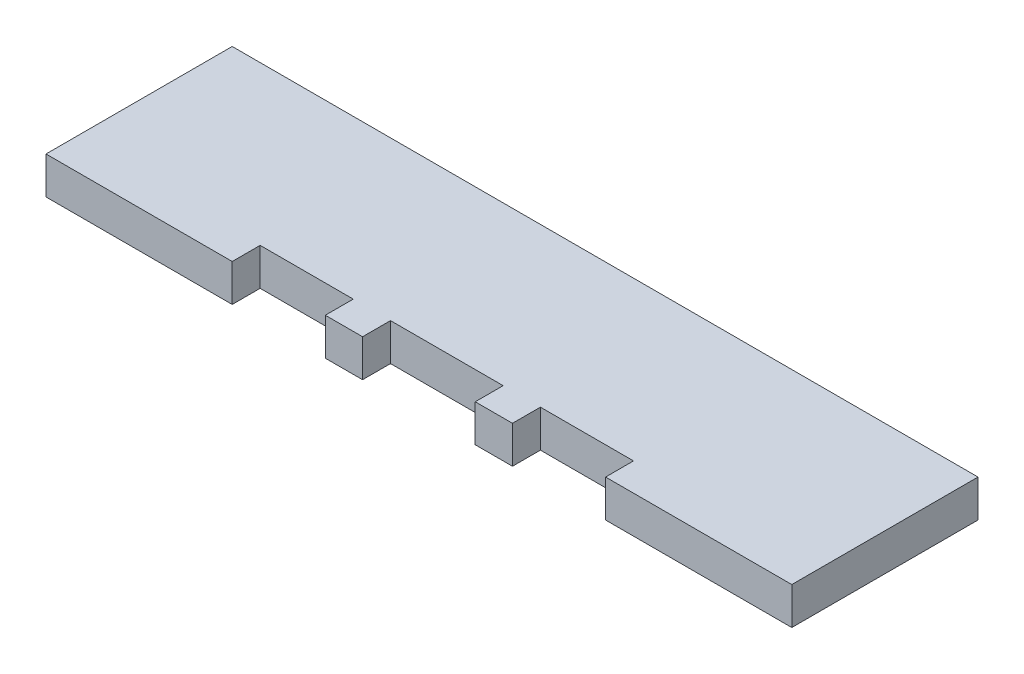
from build123d import *

# Parameters (mm, degrees)
EXTRUDE_1_DEPTH = 4
SKETCH_2_W      = 4
SKETCH_2_H      = 4
EXTRUDE_2_DEPTH = 3


with BuildPart() as part:
    # Эскиз1 → Бобышка-Вытянуть1 (new body)
    with BuildSketch(Plane(origin=(0, 0, 0), x_dir=(1, 0, 0), z_dir=(0, 1, 0))):
        Polygon((0, 0), (0, 3), (40.1, 3), (40.1, 0), (60.1, 0), (60.1, 20), (-20, 20), (-20, 0), align=None)
    extrude(amount=EXTRUDE_1_DEPTH)

    # Эскиз2 → Бобышка-Вытянуть2 (add)
    with BuildSketch(Plane.XY.offset(-3)):
        with Locations((28.1, 2)):
            Rectangle(SKETCH_2_W, SKETCH_2_H)
        with Locations((12, 2)):
            Rectangle(SKETCH_2_W, SKETCH_2_H)
    extrude(amount=EXTRUDE_2_DEPTH)


solid = part.part
